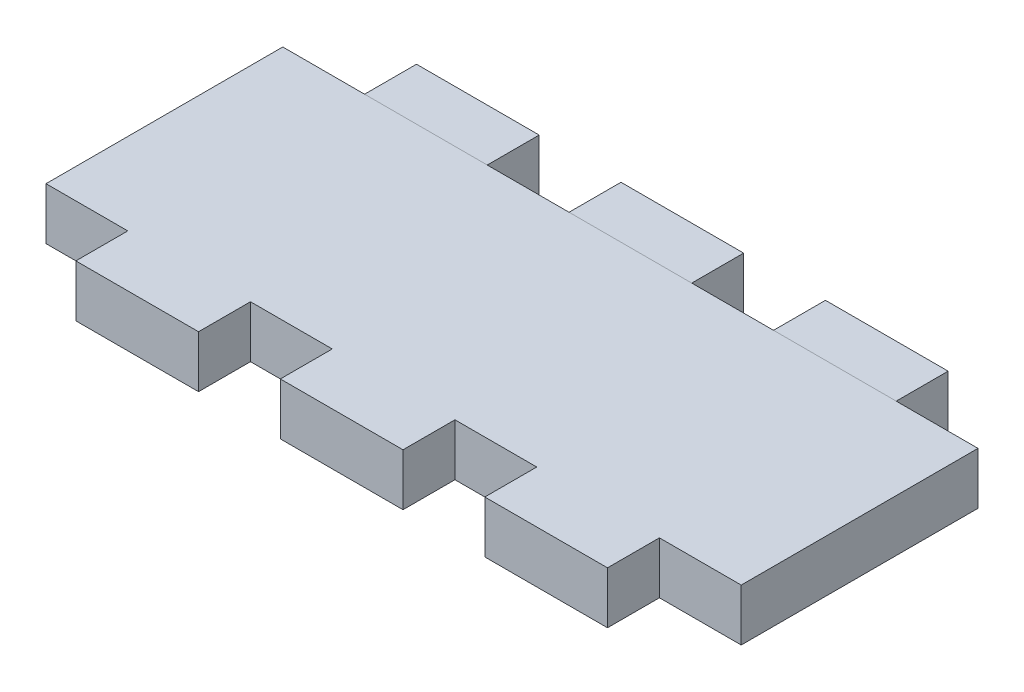
from build123d import *

# Parameters (mm, degrees)
ESQUISSE1_W          = 85
ESQUISSE1_H          = 28.95
BOSS_EXTRU_1_DEPTH   = 6.35
ESQUISSE2_W          = 15
ESQUISSE2_H          = 6.35
BOSS_EXTRU_2_DEPTH   = 6.35
BOSS_EXTRU_2_2_DEPTH = 6.35
BOSS_EXTRU_2_3_DEPTH = 6.35


with BuildPart() as part:
    # Esquisse1 → Boss.-Extru.1 (new body)
    with BuildSketch(Plane(origin=(0, 0, 0), x_dir=(1, 0, 0), z_dir=(0, 1, 0))):
        Rectangle(ESQUISSE1_W, ESQUISSE1_H)
    extrude(amount=BOSS_EXTRU_1_DEPTH)


with BuildPart() as body_2:
    # Esquisse2 → Boss.-Extru.2 (new body)
    with BuildSketch(Plane(origin=(0, 6.35, 0), x_dir=(1, 0, 0), z_dir=(0, 1, 0))):
        with Locations((-25, 17.65)):
            Rectangle(ESQUISSE2_W, ESQUISSE2_H)
    boss_extru_2 = extrude(amount=-BOSS_EXTRU_2_DEPTH)


with BuildPart() as body_3:
    # Esquisse2 → Boss.-Extru.2 2 (new body)
    with BuildSketch(Plane(origin=(0, 6.35, 0), x_dir=(1, 0, 0), z_dir=(0, 1, 0))):
        with Locations((0, 17.65)):
            Rectangle(ESQUISSE2_W, ESQUISSE2_H)
    boss_extru_2_2 = extrude(amount=-BOSS_EXTRU_2_2_DEPTH)


with BuildPart() as body_4:
    # Esquisse2 → Boss.-Extru.2 3 (new body)
    with BuildSketch(Plane(origin=(0, 6.35, 0), x_dir=(1, 0, 0), z_dir=(0, 1, 0))):
        with Locations((25, 17.65)):
            Rectangle(ESQUISSE2_W, ESQUISSE2_H)
    boss_extru_2_3 = extrude(amount=-BOSS_EXTRU_2_3_DEPTH)


with BuildPart() as part_1:
    add(part.part)

    # Symétrie1: Boss.-Extru.2, Boss.-Extru.2 2, Boss.-Extru.2 3 across plane
    add(boss_extru_2.mirror(Plane.XY))
    add(boss_extru_2_2.mirror(Plane.XY))
    add(boss_extru_2_3.mirror(Plane.XY))


solid = Compound([body_2.part, body_3.part, body_4.part, part_1.part])
